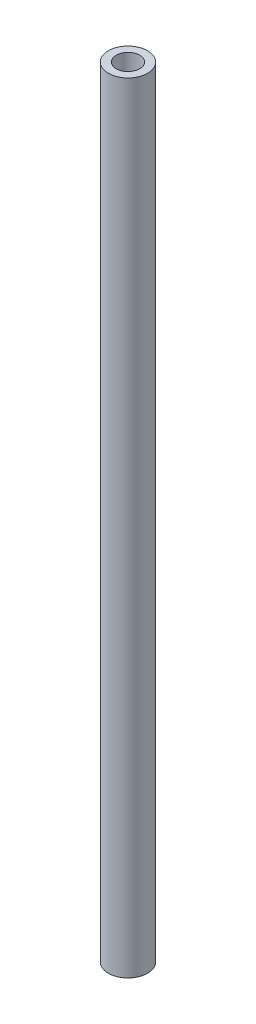
from build123d import *

# Parameters (mm, degrees)
SKETCH2_R           = 2.5
SKETCH2_R_2         = 1.5
BOSS_EXTRUDE1_DEPTH = 99.5


with BuildPart() as part:
    # Sketch2 → Boss-Extrude1 (new body)
    with BuildSketch(Plane(origin=(0, 0, 0), x_dir=(1, 0, 0), z_dir=(0, 1, 0))):
        with Locations(Location((0, 0, 0), (0, 0, 270))):
            Circle(SKETCH2_R)
        with Locations(Location((0, 0, 0), (0, 0, 270))):
            Circle(SKETCH2_R_2, mode=Mode.SUBTRACT)
    extrude(amount=BOSS_EXTRUDE1_DEPTH)


solid = part.part
